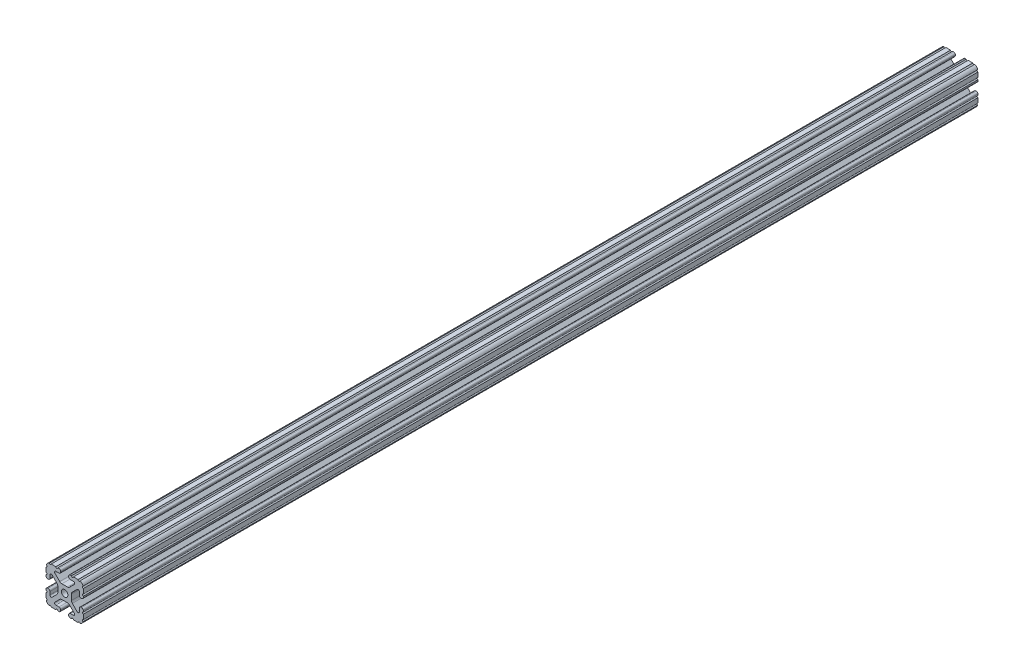
from build123d import *

# Parameters (mm, degrees)
BOSS_EXTRUDE1_DEPTH     = 457.2
CUT_EXTRUDE1_DEPTH      = 458.993062175
CUT_EXTRUDE1_DEPTH_BACK = 458.993062175
SKETCH5_R               = 1.016


with BuildPart() as part:
    # Sketch4 → Boss-Extrude1 (new, symmetric)
    with BuildSketch(Plane.XY):
        with BuildLine():
            Line((5.7912, -19.05), (14.3002, -19.05))
            ThreePointArc((14.3002, -19.05), (17.658815789, -17.658815789), (19.05, -14.3002))
            Line((19.05, -14.3002), (19.05, -5.7912))
            ThreePointArc((19.05, -5.7912), (18.544114832, -4.569885168), (17.3228, -4.064))
            Line((17.3228, -4.064), (16.7132, -4.064))
            ThreePointArc((16.7132, -4.064), (15.491885168, -4.569885168), (14.986, -5.7912))
            Line((14.986, -5.7912), (14.986, -8.996305235))
            ThreePointArc((14.986, -8.996305235), (14.189232738, -10.188751711), (12.782646215, -9.908964256))
            Line((12.782646215, -9.908964256), (7.888897763, -5.015215804))
            ThreePointArc((7.888897763, -5.015215804), (7.219915375, -4.014012907), (6.985, -2.833013566))
            Line((6.985, -2.833013566), (6.985, 0))
            Line((6.985, 0), (3.3274, 0))
            ThreePointArc((3.3274, 0), (2.352827104, -2.352827104), (0, -3.3274))
            Line((0, -3.3274), (0, -6.985))
            Line((0, -6.985), (2.833013566, -6.985))
            ThreePointArc((2.833013566, -6.985), (4.014012907, -7.219915375), (5.015215804, -7.888897763))
            Line((5.015215804, -7.888897763), (9.908964256, -12.782646215))
            ThreePointArc((9.908964256, -12.782646215), (10.188751711, -14.189232738), (8.996305235, -14.986))
            Line((8.996305235, -14.986), (5.7912, -14.986))
            ThreePointArc((5.7912, -14.986), (4.569885168, -15.491885168), (4.064, -16.7132))
            Line((4.064, -16.7132), (4.064, -17.3228))
            ThreePointArc((4.064, -17.3228), (4.569885168, -18.544114832), (5.7912, -19.05))
        make_face()
    extrude(amount=BOSS_EXTRUDE1_DEPTH, both=True)

    # Sketch5 → Cut-Extrude1 (cut, two sides: drawn at the far end of the back side and taken through both)
    with BuildSketch(Plane.XY.offset(-CUT_EXTRUDE1_DEPTH_BACK)):
        with Locations((14.739477062, -19.05)):
            Circle(SKETCH5_R)
        with Locations((7.980305235, -19.05)):
            Circle(SKETCH5_R)
        with Locations((19.05, -14.739477062)):
            Circle(SKETCH5_R)
        with Locations((19.05, -7.980305235)):
            Circle(SKETCH5_R)
    extrude(amount=CUT_EXTRUDE1_DEPTH + CUT_EXTRUDE1_DEPTH_BACK, mode=Mode.SUBTRACT)

    # Mirror1: part across plane


with BuildPart() as part_1:
    add(part.part)
    add(part.part.mirror(Plane(origin=(0, 0, 0), x_dir=(0, 0, 1), z_dir=(1, 0, 0))))

    # Mirror2: part across plane


with BuildPart() as part_2:
    add(part_1.part)
    add(part_1.part.mirror(Plane.ZX))


solid = part_2.part
